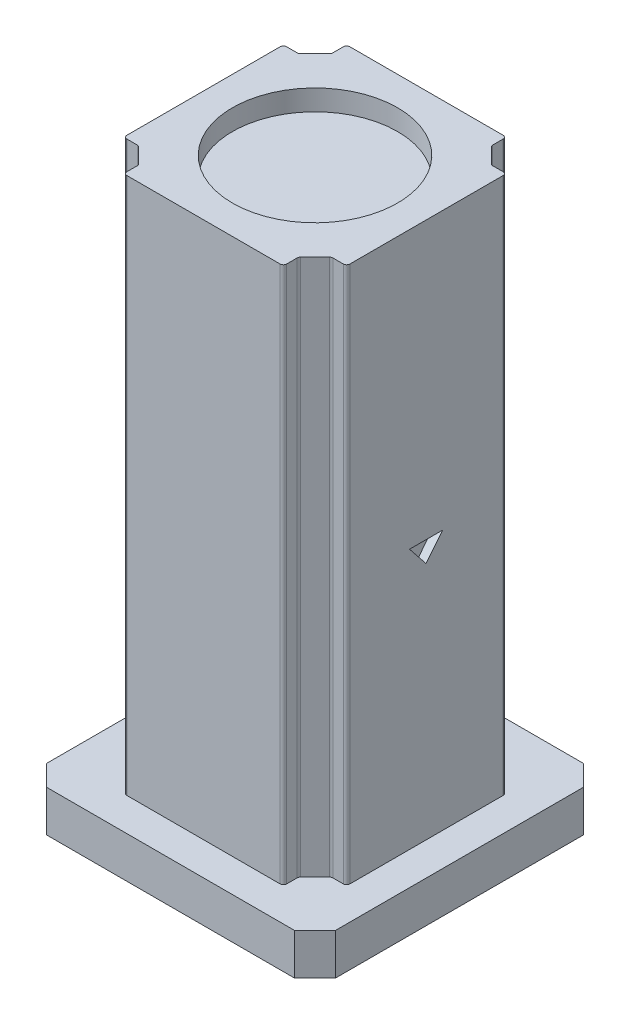
from build123d import *

# Parameters (mm, degrees)
BOSS_EXTRUDE1_DEPTH = 10
BOSS_EXTRUDE2_DEPTH = 130
FILLET1_R           = 0.8
SKETCH3_R           = 20
CUT_EXTRUDE1_DEPTH  = 5
CUT_EXTRUDE2_DEPTH  = 2


with BuildPart() as part:
    # Sketch1 → Boss-Extrude1 (new body)
    with BuildSketch(Plane(origin=(0, 0, 0), x_dir=(1, 0, 0), z_dir=(0, 1, 0))):
        Polygon((-35, 30), (-30, 35), (30, 35), (35, 30), (35, -30), (30, -35), (-30, -35), (-35, -30), align=None)
    extrude(amount=BOSS_EXTRUDE1_DEPTH)

    # Sketch2 → Boss-Extrude2 (add)
    with BuildSketch(Plane(origin=(0, 10, 0), x_dir=(1, 0, 0), z_dir=(0, 1, 0))):
        Polygon((-23.343145751, 19.343145751), (-19.343145751, 23.343145751), (-19.343145751, 27), (19.343145751, 27), (19.343145751, 23.343145751), (23.343145751, 19.343145751), (27, 19.343145751), (27, -19.343145751), (23.343145751, -19.343145751), (19.343145751, -23.343145751), (19.343145751, -27), (-19.343145751, -27), (-19.343145751, -23.343145751), (-23.343145751, -19.343145751), (-27, -19.343145751), (-27, 19.343145751), align=None)
    extrude(amount=BOSS_EXTRUDE2_DEPTH)

    # Fillet1
    fillet1_edges = [part.edges().sort_by_distance(p)[0] for p in [
        (27, 75, 19.343145751),
        (27, 75, -19.343145751),
        (23.343145751, 75, -19.343145751),
        (19.343145751, 75, -23.343145751),
        (19.343145751, 75, -27),
        (-19.343145751, 75, -27),
        (-19.343145751, 75, -23.343145751),
        (-23.343145751, 75, -19.343145751),
        (-27, 75, -19.343145751),
        (-27, 75, 19.343145751),
        (-23.343145751, 75, 19.343145751),
        (-19.343145751, 75, 23.343145751),
        (-19.343145751, 75, 27),
        (19.343145751, 75, 27),
        (19.343145751, 75, 23.343145751),
        (23.343145751, 75, 19.343145751),
    ]]
    fillet(fillet1_edges, radius=FILLET1_R)

    # Sketch3 → Cut-Extrude1 (cut)
    with BuildSketch(Plane(origin=(0, 140, 0), x_dir=(1, 0, 0), z_dir=(0, 1, 0))):
        with Locations(Location((0, 0, 0), (0, 0, 270))):
            Circle(SKETCH3_R)
    extrude(amount=-CUT_EXTRUDE1_DEPTH, mode=Mode.SUBTRACT)

    # Sketch5 → Cut-Extrude2 (cut)
    with BuildSketch(Plane(origin=(27, 0, 0), x_dir=(0, 0, -1), z_dir=(1, 0, 0))):
        Polygon((-4.112253732, 72.96796578), (3.887746268, 72.96796578), (-0.112253732, 67.96796578), align=None)
    extrude(amount=-CUT_EXTRUDE2_DEPTH, mode=Mode.SUBTRACT)


solid = part.part
